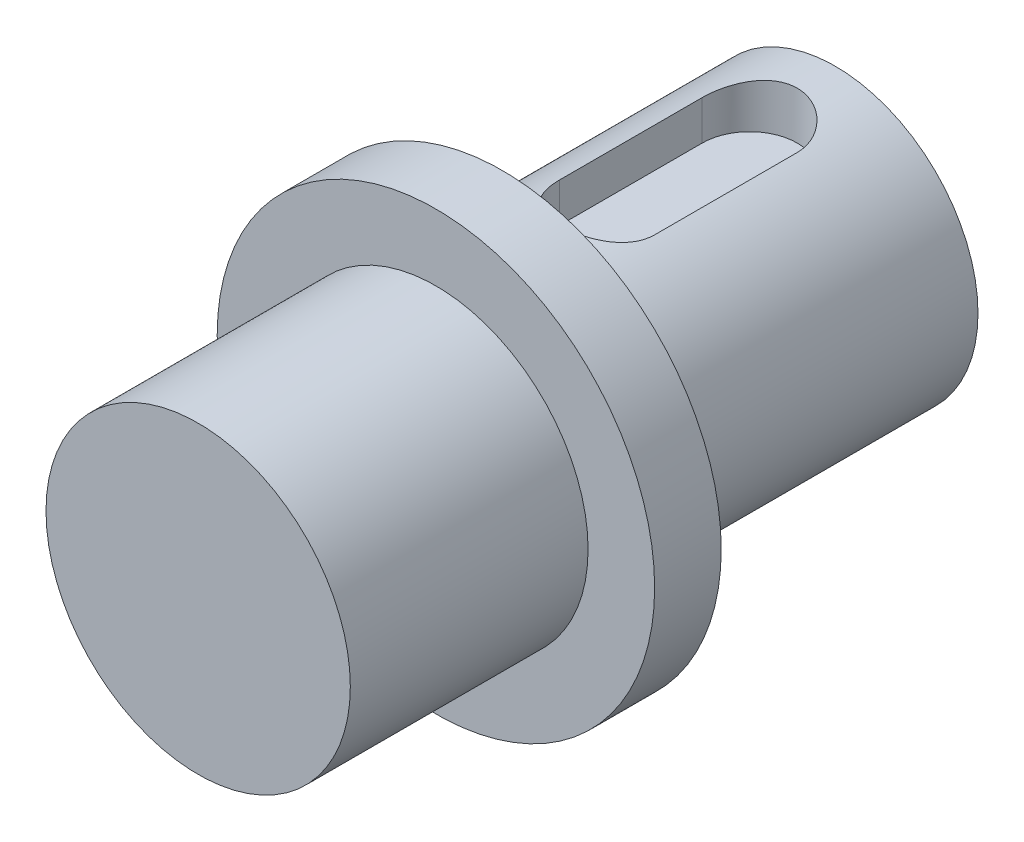
from build123d import *

# Parameters (mm, degrees)
SKETCH1_R           = 15
BOSS_EXTRUDE1_DEPTH = 35
SKETCH2_R           = 23
BOSS_EXTRUDE2_DEPTH = 7
SKETCH3_R           = 16
BOSS_EXTRUDE3_DEPTH = 25
CUT_EXTRUDE1_DEPTH  = 25


with BuildPart() as part:
    # Sketch1 → Boss-Extrude1 (new body)
    with BuildSketch(Plane.XY):
        Circle(SKETCH1_R)
    extrude(amount=BOSS_EXTRUDE1_DEPTH)

    # Sketch2 → Boss-Extrude2 (add)
    with BuildSketch(Plane.XY.offset(35)):
        Circle(SKETCH2_R)
    extrude(amount=BOSS_EXTRUDE2_DEPTH)

    # Sketch3 → Boss-Extrude3 (add)
    with BuildSketch(Plane.XY.offset(42)):
        Circle(SKETCH3_R)
    extrude(amount=BOSS_EXTRUDE3_DEPTH)

    # Sketch4 → Cut-Extrude1 (cut)
    with BuildSketch(Plane(origin=(0, 10, 0), x_dir=(1, 0, 0), z_dir=(0, 1, 0))):
        with BuildLine():
            Line((5, -24), (5, -9))
            ThreePointArc((5, -9), (0, -4), (-5, -9))
            Line((-5, -9), (-5, -24))
            ThreePointArc((-5, -24), (0, -29), (5, -24))
        make_face()
    extrude(amount=CUT_EXTRUDE1_DEPTH, mode=Mode.SUBTRACT)


solid = part.part
